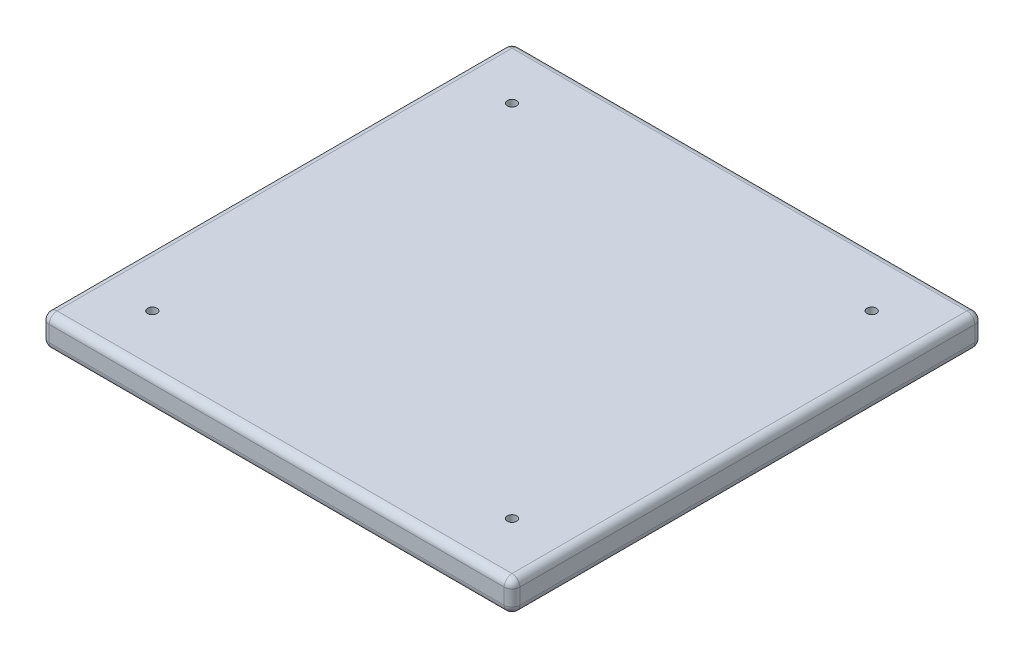
from build123d import *

# Parameters (mm, degrees)
SKETCH2_W                                  = 150
SKETCH2_H                                  = 150
BOSS_EXTRUDE1_DEPTH                        = 10
SKETCH3_R                                  = 1.5
CUT_EXTRUDE1_DEPTH                         = 10
MIRROR1_AT_THE_SECOND_PLANE_COPY_1_SKETC_R = 1.5
MIRROR1_AT_THE_SECOND_PLANE_COPY_1_DEPTH   = 10
FILLET1_R                                  = 2.5


with BuildPart() as part:
    # Sketch2 → Boss-Extrude1 (new body)
    with BuildSketch(Plane(origin=(0, 0, 0), x_dir=(1, 0, 0), z_dir=(0, 1, 0))):
        Rectangle(SKETCH2_W, SKETCH2_H)
    extrude(amount=BOSS_EXTRUDE1_DEPTH)

    # Sketch3 → Cut-Extrude1 (cut)
    with BuildSketch(Plane(origin=(0, 10, 0), x_dir=(1, 0, 0), z_dir=(0, 1, 0))):
        with Locations(Location((57.32233047, 57.32233047, 0), (0, 0, 270))):
            Circle(SKETCH3_R)
    cut_extrude1 = extrude(amount=-CUT_EXTRUDE1_DEPTH, mode=Mode.SUBTRACT)

    # Mirror1: Cut-Extrude1 across plane
    add(cut_extrude1.mirror(Plane(origin=(0, 0, 0), x_dir=(1, 0, 0), z_dir=(0, 0, -1))), mode=Mode.SUBTRACT)

    # Mirror1 at the second plane: Cut-Extrude1 across plane
    add(cut_extrude1.mirror(Plane.ZY), mode=Mode.SUBTRACT)

    # Mirror1 at the second plane copy 1 sketc → Mirror1 at the second plane copy 1 (cut)
    with BuildSketch(Plane(origin=(0, 10, 0), x_dir=(-1, 0, 0), z_dir=(0, 1, 0))):
        with Locations(Location((57.32233047, 57.32233047, 0), (0, 0, 270))):
            Circle(MIRROR1_AT_THE_SECOND_PLANE_COPY_1_SKETC_R)
    extrude(amount=-MIRROR1_AT_THE_SECOND_PLANE_COPY_1_DEPTH, mode=Mode.SUBTRACT)

    # Fillet1
    fillet1_edges = [part.edges().sort_by_distance(p)[0] for p in [
        (-75, 10, 0),
        (0, 10, 75),
        (75, 10, 0),
        (0, 0, 75),
        (-75, 0, 0),
        (0, 0, -75),
        (75, 0, 0),
        (75, 5, 75),
        (-75, 5, 75),
        (-75, 5, -75),
        (75, 5, -75),
        (0, 10, -75),
    ]]
    fillet(fillet1_edges, radius=FILLET1_R)


solid = part.part
